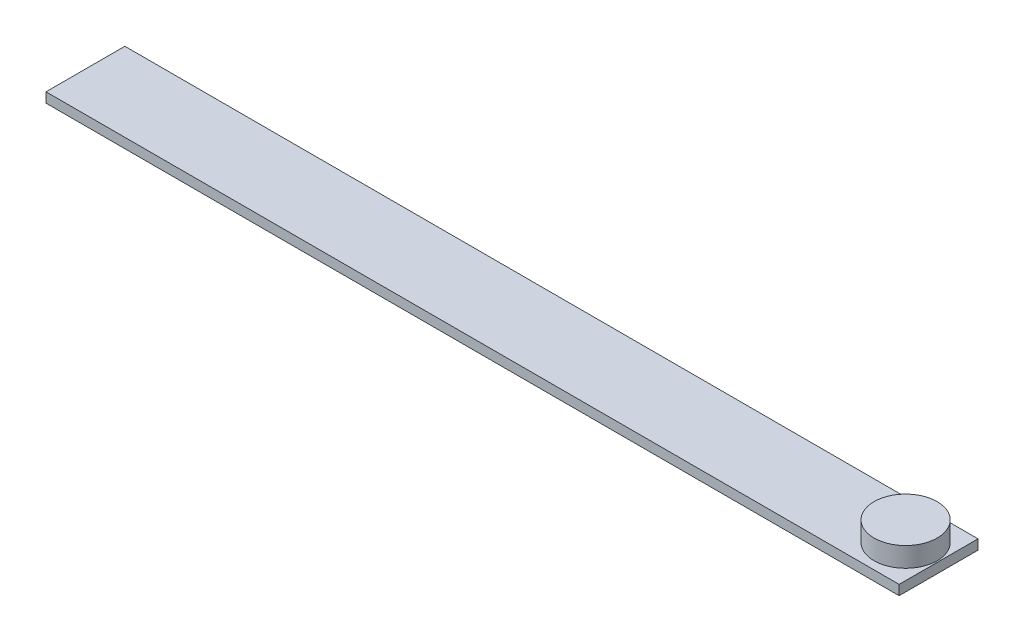
from build123d import *

# Parameters (mm, degrees)
SKETCH1_W           = 274.7645
SKETCH1_H           = 3.175
BOSS_EXTRUDE1_DEPTH = 25.4
SKETCH2_R           = 10.16
BOSS_EXTRUDE2_DEPTH = 6.35


with BuildPart() as part:
    # Sketch1 → Boss-Extrude1 (new body)
    with BuildSketch(Plane.XY):
        with Locations((137.38225, 1.5875)):
            Rectangle(SKETCH1_W, SKETCH1_H)
    extrude(amount=BOSS_EXTRUDE1_DEPTH)

    # Sketch2 → Boss-Extrude2 (add)
    with BuildSketch(Plane(origin=(0, 3.175, 0), x_dir=(1, 0, 0), z_dir=(0, 1, 0))):
        with Locations(Location((264.16, -12.7, 0), (0, 0, 90))):
            Circle(SKETCH2_R)
    extrude(amount=BOSS_EXTRUDE2_DEPTH)


solid = part.part
